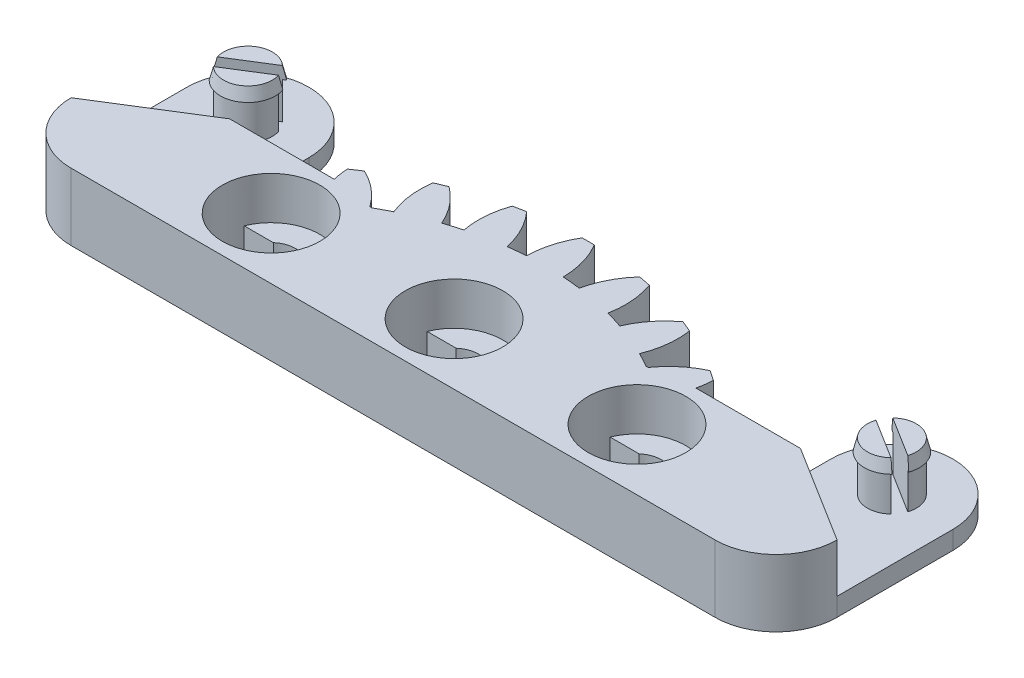
from build123d import *

# Parameters (mm, degrees)
EXTRUDE_1_DEPTH                  = 1.5
EXTRUDE_2_DEPTH                  = 4
EXTRUDE_3_DEPTH                  = 5.5
PATTERN_CIRCULAR_1_COUNT         = 4
PATTERN_CIRCULAR_1_ANGLE         = 34
PATTERN_CIRCULAR_2_COPY_1_DEPTH  = 5.5
PATTERN_CIRCULAR_2_COPY_2_DEPTH  = 5.5
PATTERN_CIRCULAR_2_COPY_3_DEPTH  = 5.5
PATTERN_CIRCULAR_2_COPY_4_DEPTH  = 5.5
PATTERN_CIRCULAR_2_COPY_5_DEPTH  = 5.5
PATTERN_CIRCULAR_2_COPY_6_DEPTH  = 5.5
PATTERN_CIRCULAR_2_COPY_7_DEPTH  = 5.5
PATTERN_CIRCULAR_2_COPY_8_DEPTH  = 5.5
PATTERN_CIRCULAR_2_COPY_9_DEPTH  = 5.5
PATTERN_CIRCULAR_2_COPY_10_DEPTH = 5.5
PATTERN_CIRCULAR_2_COPY_11_DEPTH = 5.5
PATTERN_CIRCULAR_2_COPY_12_DEPTH = 5.5
SKETCH_4_R                       = 4
CUT_EXTRUDE_1_DEPTH              = 3.5
CUT_EXTRUDE_2_DEPTH              = 35.76291127
PATTERN_LINEAR_1_COUNT           = 2
PATTERN_LINEAR_1_PITCH           = 15
PATTERN_LINEAR_1_COL_COUNT       = 2
PATTERN_LINEAR_1_COL_PITCH       = 15
SKETCH_6_R                       = 2
EXTRUDE_4_DEPTH                  = 4
SKETCH_8_R                       = 2
SKETCH_7_R                       = 2.25
CUT_EXTRUDE_3_DEPTH              = 4


with BuildPart() as part:
    # 草图1 → 凸台-拉伸1 (new body)
    with BuildSketch(Plane(origin=(0, 0, 0), x_dir=(1, 0, 0), z_dir=(0, 1, 0))):
        with BuildLine():
            Line((-26.4, -5), (26.4, -5))
            ThreePointArc((26.4, -5), (29.935533906, -3.535533906), (31.4, 0))
            Line((31.4, 0), (31.4, 9.5))
            ThreePointArc((31.4, 9.5), (26.4, 14.5), (21.4, 9.5))
            Line((21.4, 9.5), (21.4, 5))
            Line((21.4, 5), (14.9, 5))
            Line((14.9, 5), (11.25, 4.5))
            ThreePointArc((11.25, 4.5), (0, 7.5), (-11.25, 4.5))
            Line((-11.25, 4.5), (-14.9, 5))
            Line((-14.9, 5), (-21.4, 5))
            Line((-21.4, 5), (-21.4, 9.5))
            ThreePointArc((-21.4, 9.5), (-26.4, 14.5), (-31.4, 9.5))
            Line((-31.4, 9.5), (-31.4, 0))
            ThreePointArc((-31.4, 0), (-29.935533906, -3.535533906), (-26.4, -5))
        make_face()
    extrude(amount=EXTRUDE_1_DEPTH)

    # 草图2 → 凸台-拉伸2 (add)
    with BuildSketch(Plane(origin=(0, 1.5, 0), x_dir=(1, 0, 0), z_dir=(0, 1, 0))):
        with BuildLine():
            Line((-21.4, 5), (-23.4, 5))
            Line((-23.4, 5), (-31.4, 0))
            ThreePointArc((-31.4, 0), (-29.935533906, -3.535533906), (-26.4, -5))
            Line((-26.4, -5), (26.4, -5))
            ThreePointArc((26.4, -5), (29.935533906, -3.535533906), (31.4, 0))
            Line((31.4, 0), (23.4, 5))
            Line((23.4, 5), (21.4, 5))
            Line((21.4, 5), (14.9, 5))
            Line((14.9, 5), (11.25, 4.5))
            ThreePointArc((11.25, 4.5), (0, 7.5), (-11.25, 4.5))
            Line((-11.25, 4.5), (-14.9, 5))
            Line((-14.9, 5), (-21.4, 5))
        make_face()
    extrude(amount=EXTRUDE_2_DEPTH)

    # 草图3 → 凸台-拉伸3 (add)
    with BuildSketch(Plane(origin=(0, 0, 0), x_dir=(1, 0, 0), z_dir=(0, 1, 0))):
        with BuildLine():
            Line((0.5, 11), (-0.5, 11))
            ThreePointArc((-0.5, 11), (-1.238266188, 9.292132892), (-1.500585783, 7.450113497))
            ThreePointArc((-1.500585783, 7.450113497), (0, 7.5), (1.500585783, 7.450113497))
            ThreePointArc((1.500585783, 7.450113497), (1.238266188, 9.292132892), (0.5, 11))
        make_face()
    extrude_3 = extrude(amount=EXTRUDE_3_DEPTH)

    # 阵列(圆周)1: 凸台-拉伸3 ×4 about axis
    pattern_circular_1_axis = Axis((0, 0, 15.09375), (0, -1, 0))
    for i in range(1, PATTERN_CIRCULAR_1_COUNT):
        add(extrude_3.rotate(pattern_circular_1_axis, i * PATTERN_CIRCULAR_1_ANGLE / (PATTERN_CIRCULAR_1_COUNT - 1)))

    # 阵列(圆周)2 copy 1 sketch → 阵列(圆周)2 copy 1 (add)
    with BuildSketch(Plane(origin=(0, 0, 0), x_dir=(1, 0, 0), z_dir=(0, 1, 0))):
        with BuildLine():
            Line((0.5, 11), (-0.5, 11))
            ThreePointArc((-0.5, 11), (-1.238266188, 9.292132892), (-1.500585783, 7.450113497))
            ThreePointArc((-1.500585783, 7.450113497), (0, 7.5), (1.500585783, 7.450113497))
            ThreePointArc((1.500585783, 7.450113497), (1.238266188, 9.292132892), (0.5, 11))
        make_face()
    extrude(amount=PATTERN_CIRCULAR_2_COPY_1_DEPTH)

    # 阵列(圆周)2 copy 2 sketch → 阵列(圆周)2 copy 2 (add)
    with BuildSketch(Plane(origin=(-2.966172575, 0, 0.294320642), x_dir=(0.9805004957559792, 0, -0.1965166095328305), z_dir=(0, 1, 0))):
        with BuildLine():
            Line((0.5, 11), (-0.5, 11))
            ThreePointArc((-0.5, 11), (-1.238266188, 9.292132892), (-1.500585783, 7.450113497))
            ThreePointArc((-1.500585783, 7.450113497), (0, 7.5), (1.500585783, 7.450113497))
            ThreePointArc((1.500585783, 7.450113497), (1.238266188, 9.292132892), (0.5, 11))
        make_face()
    extrude(amount=PATTERN_CIRCULAR_2_COPY_2_DEPTH)

    # 阵列(圆周)2 copy 3 sketch → 阵列(圆周)2 copy 3 (add)
    with BuildSketch(Plane(origin=(-5.816667361, 0, 1.165804356), x_dir=(0.922762444355442, 0, -0.3853692661424491), z_dir=(0, 1, 0))):
        with BuildLine():
            Line((0.5, 11), (-0.5, 11))
            ThreePointArc((-0.5, 11), (-1.238266188, 9.292132892), (-1.500585783, 7.450113497))
            ThreePointArc((-1.500585783, 7.450113497), (0, 7.5), (1.500585783, 7.450113497))
            ThreePointArc((1.500585783, 7.450113497), (1.238266188, 9.292132892), (0.5, 11))
        make_face()
    extrude(amount=PATTERN_CIRCULAR_2_COPY_3_DEPTH)

    # 阵列(圆周)2 copy 4 sketch → 阵列(圆周)2 copy 4 (add)
    with BuildSketch(Plane(origin=(2.966172575, 0, 0.294320642), x_dir=(0.9805004957559792, 0, 0.1965166095328305), z_dir=(0, 1, 0))):
        with BuildLine():
            Line((0.5, 11), (-0.5, 11))
            ThreePointArc((-0.5, 11), (-1.238266188, 9.292132892), (-1.500585783, 7.450113497))
            ThreePointArc((-1.500585783, 7.450113497), (0, 7.5), (1.500585783, 7.450113497))
            ThreePointArc((1.500585783, 7.450113497), (1.238266188, 9.292132892), (0.5, 11))
        make_face()
    extrude(amount=PATTERN_CIRCULAR_2_COPY_4_DEPTH)

    # 阵列(圆周)2 copy 5 sketch → 阵列(圆周)2 copy 5 (add)
    with BuildSketch(Plane(origin=(0, 0, 0), x_dir=(1, 0, 0), z_dir=(0, 1, 0))):
        with BuildLine():
            Line((0.5, 11), (-0.5, 11))
            ThreePointArc((-0.5, 11), (-1.238266188, 9.292132892), (-1.500585783, 7.450113497))
            ThreePointArc((-1.500585783, 7.450113497), (0, 7.5), (1.500585783, 7.450113497))
            ThreePointArc((1.500585783, 7.450113497), (1.238266188, 9.292132892), (0.5, 11))
        make_face()
    extrude(amount=PATTERN_CIRCULAR_2_COPY_5_DEPTH)

    # 阵列(圆周)2 copy 6 sketch → 阵列(圆周)2 copy 6 (add)
    with BuildSketch(Plane(origin=(-2.966172575, 0, 0.294320642), x_dir=(0.9805004957559792, 0, -0.19651660953283062), z_dir=(0, 1, 0))):
        with BuildLine():
            Line((0.5, 11), (-0.5, 11))
            ThreePointArc((-0.5, 11), (-1.238266188, 9.292132892), (-1.500585783, 7.450113497))
            ThreePointArc((-1.500585783, 7.450113497), (0, 7.5), (1.500585783, 7.450113497))
            ThreePointArc((1.500585783, 7.450113497), (1.238266188, 9.292132892), (0.5, 11))
        make_face()
    extrude(amount=PATTERN_CIRCULAR_2_COPY_6_DEPTH)

    # 阵列(圆周)2 copy 7 sketch → 阵列(圆周)2 copy 7 (add)
    with BuildSketch(Plane(origin=(5.816667361, 0, 1.165804356), x_dir=(0.922762444355442, 0, 0.3853692661424491), z_dir=(0, 1, 0))):
        with BuildLine():
            Line((0.5, 11), (-0.5, 11))
            ThreePointArc((-0.5, 11), (-1.238266188, 9.292132892), (-1.500585783, 7.450113497))
            ThreePointArc((-1.500585783, 7.450113497), (0, 7.5), (1.500585783, 7.450113497))
            ThreePointArc((1.500585783, 7.450113497), (1.238266188, 9.292132892), (0.5, 11))
        make_face()
    extrude(amount=PATTERN_CIRCULAR_2_COPY_7_DEPTH)

    # 阵列(圆周)2 copy 8 sketch → 阵列(圆周)2 copy 8 (add)
    with BuildSketch(Plane(origin=(2.966172575, 0, 0.294320642), x_dir=(0.9805004957559792, 0, 0.19651660953283062), z_dir=(0, 1, 0))):
        with BuildLine():
            Line((0.5, 11), (-0.5, 11))
            ThreePointArc((-0.5, 11), (-1.238266188, 9.292132892), (-1.500585783, 7.450113497))
            ThreePointArc((-1.500585783, 7.450113497), (0, 7.5), (1.500585783, 7.450113497))
            ThreePointArc((1.500585783, 7.450113497), (1.238266188, 9.292132892), (0.5, 11))
        make_face()
    extrude(amount=PATTERN_CIRCULAR_2_COPY_8_DEPTH)

    # 阵列(圆周)2 copy 9 sketch → 阵列(圆周)2 copy 9 (add)
    with BuildSketch(Plane(origin=(0, 0, 0), x_dir=(1, 0, 0), z_dir=(0, 1, 0))):
        with BuildLine():
            Line((0.5, 11), (-0.5, 11))
            ThreePointArc((-0.5, 11), (-1.238266188, 9.292132892), (-1.500585783, 7.450113497))
            ThreePointArc((-1.500585783, 7.450113497), (0, 7.5), (1.500585783, 7.450113497))
            ThreePointArc((1.500585783, 7.450113497), (1.238266188, 9.292132892), (0.5, 11))
        make_face()
    extrude(amount=PATTERN_CIRCULAR_2_COPY_9_DEPTH)

    # 阵列(圆周)2 copy 10 sketch → 阵列(圆周)2 copy 10 (add)
    with BuildSketch(Plane(origin=(-2.966172575, 0, 0.294320642), x_dir=(0.9805004957559792, 0, -0.19651660953283054), z_dir=(0, 1, 0))):
        with BuildLine():
            Line((0.5, 11), (-0.5, 11))
            ThreePointArc((-0.5, 11), (-1.238266188, 9.292132892), (-1.500585783, 7.450113497))
            ThreePointArc((-1.500585783, 7.450113497), (0, 7.5), (1.500585783, 7.450113497))
            ThreePointArc((1.500585783, 7.450113497), (1.238266188, 9.292132892), (0.5, 11))
        make_face()
    extrude(amount=PATTERN_CIRCULAR_2_COPY_10_DEPTH)

    # 阵列(圆周)2 copy 11 sketch → 阵列(圆周)2 copy 11 (add)
    with BuildSketch(Plane(origin=(-5.816667361, 0, 1.165804356), x_dir=(0.9227624443554421, 0, -0.38536926614244904), z_dir=(0, 1, 0))):
        with BuildLine():
            Line((0.5, 11), (-0.5, 11))
            ThreePointArc((-0.5, 11), (-1.238266188, 9.292132892), (-1.500585783, 7.450113497))
            ThreePointArc((-1.500585783, 7.450113497), (0, 7.5), (1.500585783, 7.450113497))
            ThreePointArc((1.500585783, 7.450113497), (1.238266188, 9.292132892), (0.5, 11))
        make_face()
    extrude(amount=PATTERN_CIRCULAR_2_COPY_11_DEPTH)

    # 阵列(圆周)2 copy 12 sketch → 阵列(圆周)2 copy 12 (add)
    with BuildSketch(Plane(origin=(-8.440317887, 0, 2.580464139), x_dir=(0.829037572555041, 0, -0.5591929034707479), z_dir=(0, 1, 0))):
        with BuildLine():
            Line((0.5, 11), (-0.5, 11))
            ThreePointArc((-0.5, 11), (-1.238266188, 9.292132892), (-1.500585783, 7.450113497))
            ThreePointArc((-1.500585783, 7.450113497), (0, 7.5), (1.500585783, 7.450113497))
            ThreePointArc((1.500585783, 7.450113497), (1.238266188, 9.292132892), (0.5, 11))
        make_face()
    extrude(amount=PATTERN_CIRCULAR_2_COPY_12_DEPTH)

    # 草图4 → 切除-拉伸1 (cut)
    with BuildSketch(Plane(origin=(0, 5.5, 0), x_dir=(1, 0, 0), z_dir=(0, 1, 0))):
        with Locations(Location((0, 0, 0), (0, 0, 270))):
            Circle(SKETCH_4_R)
    cut_extrude_1 = extrude(amount=-CUT_EXTRUDE_1_DEPTH, mode=Mode.SUBTRACT)

    # 草图5 → 切除-拉伸2 (cut, through all)
    with BuildSketch(Plane(origin=(0, 2, 0), x_dir=(1, 0, 0), z_dir=(0, 1, 0))):
        with BuildLine():
            Line((-1.322875656, 1.5), (-3.708099244, 1.5))
            ThreePointArc((-3.708099244, 1.5), (-4, 0), (-3.708099244, -1.5))
            Line((-3.708099244, -1.5), (-1.322875656, -1.5))
            ThreePointArc((-1.322875656, -1.5), (0, -2), (1.322875656, -1.5))
            Line((1.322875656, -1.5), (3.708099244, -1.5))
            ThreePointArc((3.708099244, -1.5), (4, 0), (3.708099244, 1.5))
            Line((3.708099244, 1.5), (1.322875656, 1.5))
            ThreePointArc((1.322875656, 1.5), (0, 2), (-1.322875656, 1.5))
        make_face()
    cut_extrude_2 = extrude(amount=-CUT_EXTRUDE_2_DEPTH, mode=Mode.SUBTRACT)

    # 阵列(线性)1: 切除-拉伸1, 切除-拉伸2 ×2
    with Locations(*[(-i * PATTERN_LINEAR_1_PITCH, 0, 0) for i in range(1, PATTERN_LINEAR_1_COUNT)]):
        add(cut_extrude_1, mode=Mode.SUBTRACT)
        add(cut_extrude_2, mode=Mode.SUBTRACT)

    # 阵列(线性)1 col: 切除-拉伸1, 切除-拉伸2 ×2
    with Locations(*[(i * PATTERN_LINEAR_1_COL_PITCH, 0, 0) for i in range(1, PATTERN_LINEAR_1_COL_COUNT)]):
        add(cut_extrude_1, mode=Mode.SUBTRACT)
        add(cut_extrude_2, mode=Mode.SUBTRACT)

    # 草图6 → 凸台-拉伸4 (add)
    with BuildSketch(Plane(origin=(0, 1.5, 0), x_dir=(1, 0, 0), z_dir=(0, 1, 0))):
        with Locations(Location((-26.4, 9.5, 0), (0, 0, 270))):
            Circle(SKETCH_6_R)
    extrude_4 = extrude(amount=EXTRUDE_4_DEPTH)

    # 草图8 → 放样1 section 0
    with BuildSketch(Plane(origin=(0, 5.5, 0), x_dir=(1, 0, 0), z_dir=(0, 1, 0))):
        with Locations((-26.4, 9.5)):
            Circle(SKETCH_8_R)
    # 草图7 → 放样1 section 1
    with BuildSketch(Plane(origin=(0, 4.5, 0), x_dir=(1, 0, 0), z_dir=(0, 1, 0))):
        with Locations((-26.4, 9.5)):
            Circle(SKETCH_7_R)
    loft_1 = loft()

    # 草图9 → 切除-拉伸3 (cut)
    with BuildSketch(Plane(origin=(0, 5.5, 0), x_dir=(1, 0, 0), z_dir=(0, 1, 0))):
        Polygon((-28.678995442, 7.486004028), (-23.591005618, 10.665997668), (-24.121004558, 11.513995972), (-29.208994382, 8.334002332), align=None)
    cut_extrude_3 = extrude(amount=-CUT_EXTRUDE_3_DEPTH, mode=Mode.SUBTRACT)

    # 镜向1: 凸台-拉伸4, 放样1, 切除-拉伸3 across plane
    add(extrude_4.mirror(Plane(origin=(0, 0, 0), x_dir=(0, 0, 1), z_dir=(1, 0, 0))))
    add(loft_1.mirror(Plane(origin=(0, 0, 0), x_dir=(0, 0, 1), z_dir=(1, 0, 0))))
    add(cut_extrude_3.mirror(Plane(origin=(0, 0, 0), x_dir=(0, 0, 1), z_dir=(1, 0, 0))), mode=Mode.SUBTRACT)


solid = part.part
